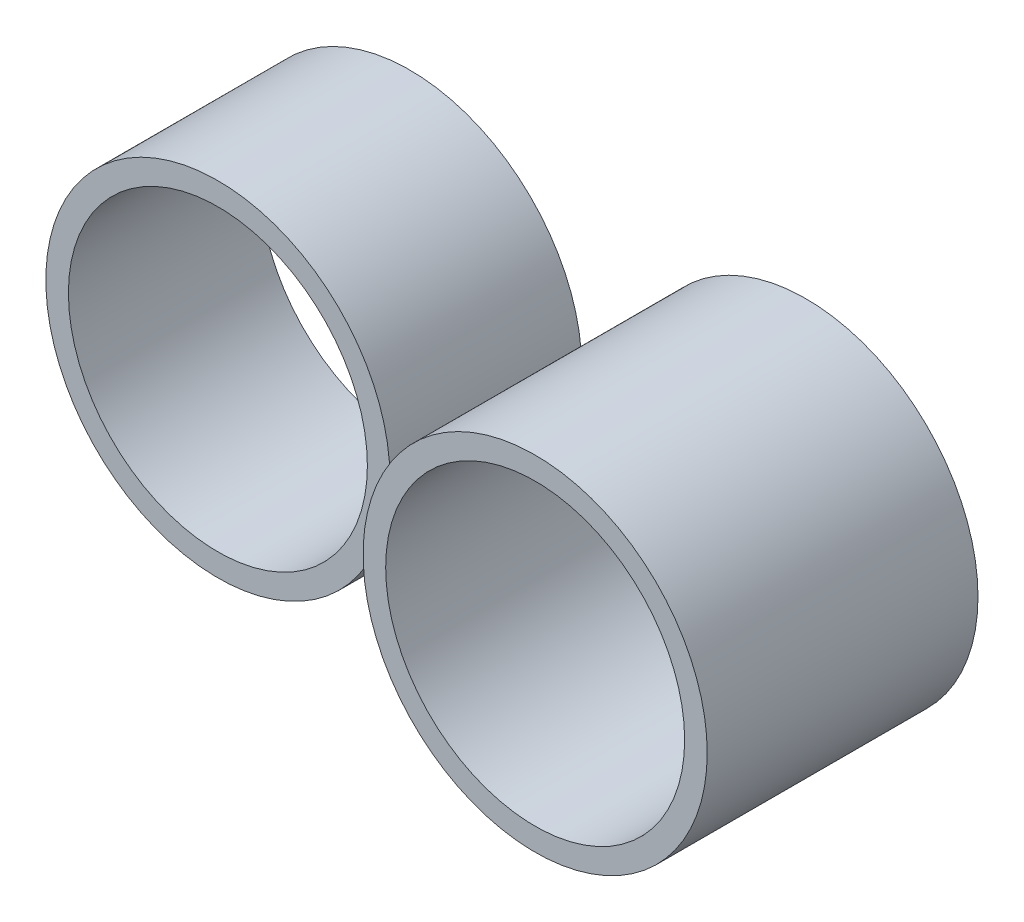
from build123d import *

# Parameters (mm, degrees)
SKETCH1_R           = 6.1
SKETCH1_R_2         = 5.3
BOSS_EXTRUDE1_DEPTH = 6.8
SKETCH1_3_R         = 6.1
SKETCH1_3_R_2       = 5.3
BOSS_EXTRUDE2_DEPTH = 9.6


with BuildPart() as part:
    # Sketch1 → Boss-Extrude1 (new body)
    with BuildSketch(Plane.XY):
        with Locations((-7.0240764, 0)):
            Circle(SKETCH1_R)
        with Locations((-7.0240764, 0)):
            Circle(SKETCH1_R_2, mode=Mode.SUBTRACT)
    extrude(amount=BOSS_EXTRUDE1_DEPTH)


with BuildPart() as body_2:
    # Sketch1<3> → Boss-Extrude2 (new body)
    with BuildSketch(Plane.XY):
        with Locations((7.0240764, 0)):
            Circle(SKETCH1_3_R)
        with Locations((7.0240764, 0)):
            Circle(SKETCH1_3_R_2, mode=Mode.SUBTRACT)
    extrude(amount=BOSS_EXTRUDE2_DEPTH)


solid = Compound([part.part, body_2.part])
